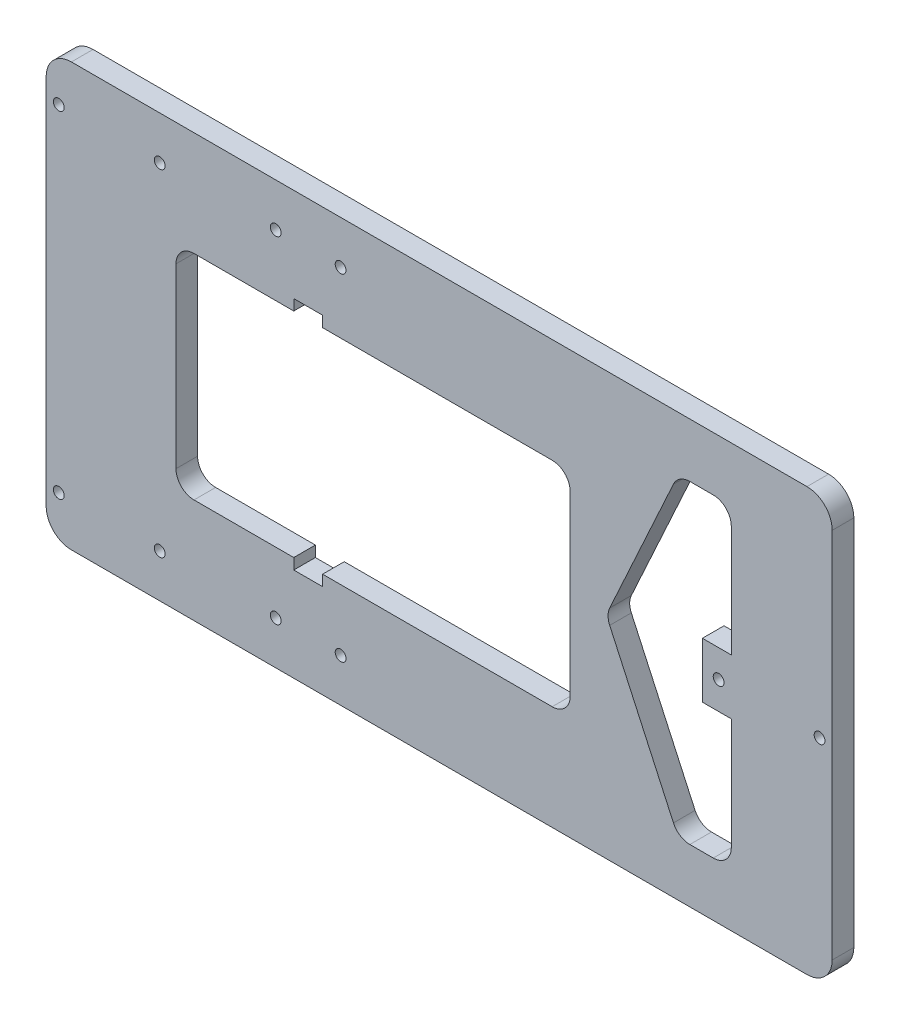
from build123d import *

# Parameters (mm, degrees)
SKETCH1_W           = 218
SKETCH1_H           = 117.2
SKETCH1_R           = 1.5
BOSS_EXTRUDE1_DEPTH = 6
SKETCH2_R           = 1.5
CUT_EXTRUDE1_DEPTH  = 6
FILLET1_R           = 7
SKETCH3_W           = 109.333333333
SKETCH3_H           = 59.2
CUT_EXTRUDE2_DEPTH  = 10
FILLET3_R           = 5
CUT_EXTRUDE3_DEPTH  = 10
FILLET4_R           = 5
SKETCH5_W           = 8
SKETCH5_H           = 65.2
CUT_EXTRUDE4_DEPTH  = 10


with BuildPart() as part:
    # Sketch1 → Boss-Extrude1 (new body)
    with BuildSketch(Plane.XY):
        with Locations((-150.609177744, 197.743600407)):
            Rectangle(SKETCH1_W, SKETCH1_H)
        with Locations((-256.109177744, 151.143600407)):
            Circle(SKETCH1_R, mode=Mode.SUBTRACT)
        with Locations((-228.109177744, 151.143600407)):
            Circle(SKETCH1_R, mode=Mode.SUBTRACT)
        with Locations((-73.109177744, 197.743600407)):
            Circle(SKETCH1_R, mode=Mode.SUBTRACT)
        with Locations((-45.109177744, 197.743600407)):
            Circle(SKETCH1_R, mode=Mode.SUBTRACT)
        with Locations((-256.109177744, 244.343600407)):
            Circle(SKETCH1_R, mode=Mode.SUBTRACT)
        with Locations((-228.109177744, 244.343600407)):
            Circle(SKETCH1_R, mode=Mode.SUBTRACT)
    extrude(amount=BOSS_EXTRUDE1_DEPTH)

    # Sketch2 → Cut-Extrude1 (cut)
    with BuildSketch(Plane.XY.offset(6)):
        with Locations((-195.942511077, 151.143600407)):
            Circle(SKETCH2_R)
        with Locations((-177.942511077, 151.143600407)):
            Circle(SKETCH2_R)
        with Locations((-195.942511077, 244.343600407)):
            Circle(SKETCH2_R)
        with Locations((-177.942511077, 244.343600407)):
            Circle(SKETCH2_R)
    extrude(amount=-CUT_EXTRUDE1_DEPTH, mode=Mode.SUBTRACT)

    # Fillet1
    fillet1_edges = [part.edges().sort_by_distance(p)[0] for p in [
        (-41.609177744, 139.143600407, 3),
        (-41.609177744, 256.343600407, 3),
        (-259.609177744, 139.143600407, 3),
        (-259.609177744, 256.343600407, 3),
    ]]
    fillet(fillet1_edges, radius=FILLET1_R)

    # Sketch3 → Cut-Extrude2 (cut)
    with BuildSketch(Plane(origin=(0, 0, 0), x_dir=(-1, 0, 0), z_dir=(0, 0, -1))):
        with Locations((168.942511078, 197.743600407)):
            Rectangle(SKETCH3_W, SKETCH3_H)
    extrude(amount=-CUT_EXTRUDE2_DEPTH, mode=Mode.SUBTRACT)

    # Fillet3
    fillet3_edges = [part.edges().sort_by_distance(p)[0] for p in [
        (-114.275844411, 168.143600407, 3),
        (-223.609177744, 168.143600407, 3),
        (-223.609177744, 227.343600407, 3),
        (-114.275844411, 227.343600407, 3),
    ]]
    fillet(fillet3_edges, radius=FILLET3_R)

    # Sketch4 → Cut-Extrude3 (cut)
    with BuildSketch(Plane(origin=(0, 0, 0), x_dir=(-1, 0, 0), z_dir=(0, 0, -1))):
        Polygon((84.298987117, 241.343600407), (69.597266226, 241.343600407), (69.597266226, 205.418600407), (77.609177744, 205.418600407), (77.609177744, 190.068600407), (69.597266226, 190.068600407), (69.597266226, 154.143600407), (84.298987117, 154.143600407), (104.275844411, 197.743600407), align=None)
    extrude(amount=-CUT_EXTRUDE3_DEPTH, mode=Mode.SUBTRACT)

    # Fillet4
    fillet4_edges = [part.edges().sort_by_distance(p)[0] for p in [
        (-69.597266226, 154.143600407, 3),
        (-84.298987117, 154.143600407, 3),
        (-104.275844411, 197.743600407, 3),
        (-84.298987117, 241.343600407, 3),
        (-69.597266226, 241.343600407, 3),
    ]]
    fillet(fillet4_edges, radius=FILLET4_R)

    # Sketch5 → Cut-Extrude4 (cut)
    with BuildSketch(Plane(origin=(0, 0, 0), x_dir=(-1, 0, 0), z_dir=(0, 0, -1))):
        with Locations((186.942511077, 197.743600407)):
            Rectangle(SKETCH5_W, SKETCH5_H)
    extrude(amount=-CUT_EXTRUDE4_DEPTH, mode=Mode.SUBTRACT)


solid = part.part
